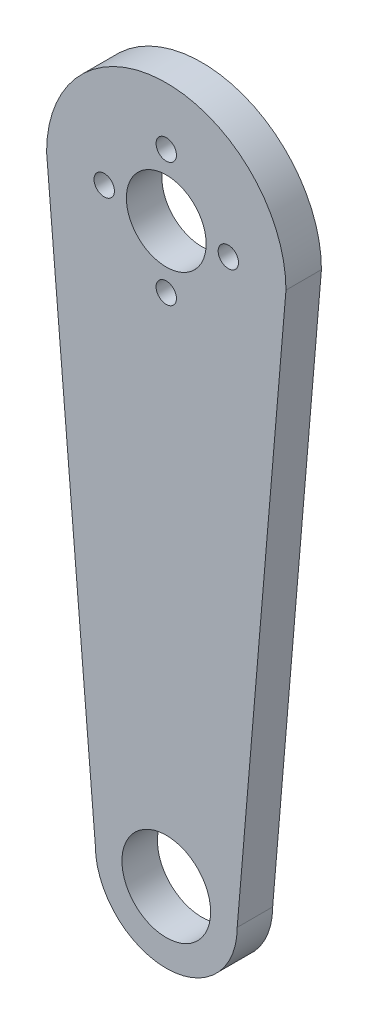
from build123d import *

# Parameters (mm, degrees)
SKETCH_1_R      = 4.5
SKETCH_1_R_2    = 1.15
SKETCH_1_R_3    = 5
EXTRUDE_1_DEPTH = 4


with BuildPart() as part:
    # 草图1 → 凸台-拉伸1 (new body)
    with BuildSketch(Plane.XY):
        with BuildLine():
            Line((-13.5, 0), (-8, -65))
            ThreePointArc((-8, -65), (0, -73), (8, -65))
            Line((8, -65), (13.5, 0))
            ThreePointArc((13.5, 0), (0, 13.5), (-13.5, 0))
        make_face()
        Circle(SKETCH_1_R, mode=Mode.SUBTRACT)
        with Locations((0, 7)):
            Circle(SKETCH_1_R_2, mode=Mode.SUBTRACT)
        with Locations((7, 0)):
            Circle(SKETCH_1_R_2, mode=Mode.SUBTRACT)
        with Locations((0, -7)):
            Circle(SKETCH_1_R_2, mode=Mode.SUBTRACT)
        with Locations((-7, 0)):
            Circle(SKETCH_1_R_2, mode=Mode.SUBTRACT)
        with Locations((0, -65)):
            Circle(SKETCH_1_R_3, mode=Mode.SUBTRACT)
    extrude(amount=EXTRUDE_1_DEPTH)


solid = part.part
